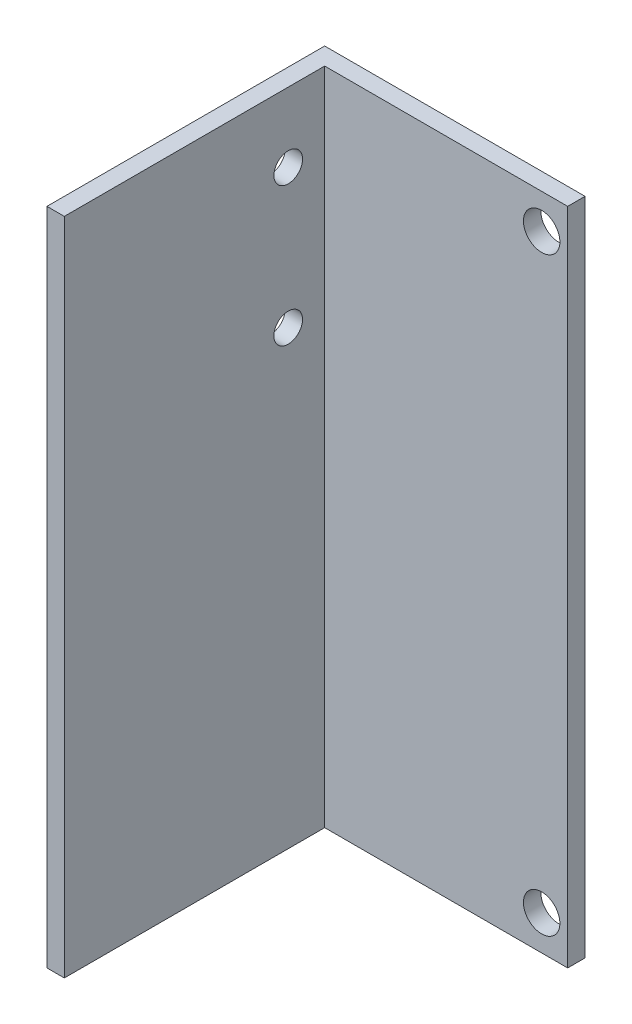
from build123d import *

# Parameters (mm, degrees)
SKETCH_1_W          = 30
SKETCH_1_H          = 76
EXTRUDE_1_DEPTH     = 2
SKETCH_2_W          = 2
SKETCH_2_H          = 76
EXTRUDE_2_DEPTH     = 30
SKETCH_3_R          = 2.1
CUT_EXTRUDE_3_DEPTH = 88.749643874
SKETCH_4_R          = 1.65
CUT_EXTRUDE_4_DEPTH = 88.749643874


with BuildPart() as part:
    # ｽｹｯﾁ1 → 押し出し1 (new body)
    with BuildSketch(Plane.XY):
        with Locations((15, -38)):
            Rectangle(SKETCH_1_W, SKETCH_1_H)
    extrude(amount=EXTRUDE_1_DEPTH)

    # ｽｹｯﾁ2 → 押し出し2 (add)
    with BuildSketch(Plane.XY.offset(2)):
        with Locations((1, -38)):
            Rectangle(SKETCH_2_W, SKETCH_2_H)
    extrude(amount=EXTRUDE_2_DEPTH)

    # ｽｹｯﾁ3 → 押し出し3 (cut, through all)
    with BuildSketch(Plane(origin=(0, 0, 0), x_dir=(-1, 0, 0), z_dir=(0, 0, -1))):
        with Locations((-27, -4)):
            Circle(SKETCH_3_R)
        with Locations((-27, -72)):
            Circle(SKETCH_3_R)
    extrude(amount=-CUT_EXTRUDE_3_DEPTH, mode=Mode.SUBTRACT)

    # ｽｹｯﾁ4 → 押し出し4 (cut, through all)
    with BuildSketch(Plane.ZY):
        with Locations(Location((6.2, -8, 0), (0, 0, 270))):
            Circle(SKETCH_4_R)
        with Locations(Location((6.2, -24, 0), (0, 0, 270))):
            Circle(SKETCH_4_R)
    extrude(amount=-CUT_EXTRUDE_4_DEPTH, mode=Mode.SUBTRACT)


solid = part.part
